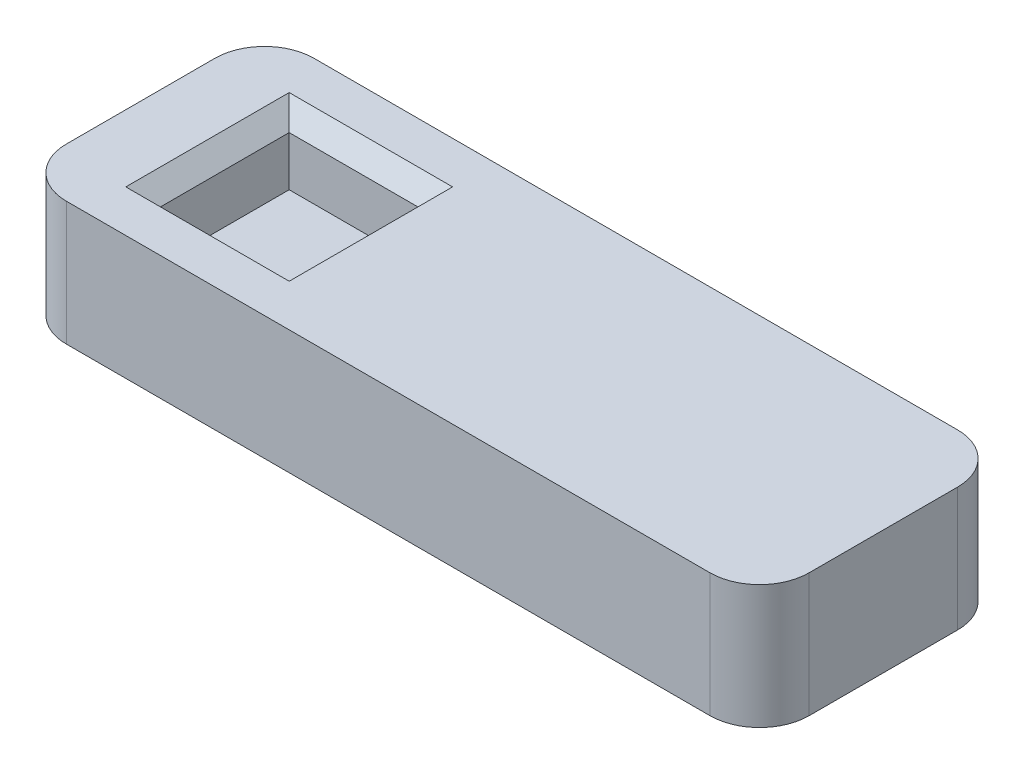
from build123d import *

# Parameters (mm, degrees)
ESBO_O1_W                = 30
ESBO_O1_H                = 10
RESSALTO_EXTRUS_O1_DEPTH = 5
ESBO_O2_W                = 5.2
ESBO_O2_H                = 5.2
CORTE_EXTRUS_O1_DEPTH    = 2.7
CHANFRO1_SIZE            = 0.7
FILETE1_R                = 2
FILETE2_R                = 2
FILETE3_R                = 2
FILETE4_R                = 2


with BuildPart() as part:
    # Esboço1 → Ressalto-extrusão1 (new body)
    with BuildSketch(Plane(origin=(0, 0, 0), x_dir=(1, 0, 0), z_dir=(0, 1, 0))):
        with Locations((15, 5)):
            Rectangle(ESBO_O1_W, ESBO_O1_H)
    extrude(amount=RESSALTO_EXTRUS_O1_DEPTH)

    # Esboço2 → Corte-extrusão1 (cut)
    with BuildSketch(Plane(origin=(0, 5, 0), x_dir=(1, 0, 0), z_dir=(0, 1, 0))):
        with Locations((6, 5)):
            Rectangle(ESBO_O2_W, ESBO_O2_H)
    extrude(amount=-CORTE_EXTRUS_O1_DEPTH, mode=Mode.SUBTRACT)

    # Chanfro1
    chanfro1_edges = [part.edges().sort_by_distance(p)[0] for p in [
        (8.6, 5, -5),
        (6, 5, -7.6),
        (3.4, 5, -5),
        (6, 5, -2.4),
    ]]
    chamfer(chanfro1_edges, length=CHANFRO1_SIZE)

    # Filete1
    filete1_edges = [part.edges().sort_by_distance(p)[0] for p in [
        (30, 2.5, 0),
    ]]
    fillet(filete1_edges, radius=FILETE1_R)

    # Filete2
    filete2_edges = [part.edges().sort_by_distance(p)[0] for p in [
        (30, 2.5, -10),
    ]]
    fillet(filete2_edges, radius=FILETE2_R)

    # Filete3
    filete3_edges = [part.edges().sort_by_distance(p)[0] for p in [
        (0, 2.5, 0),
    ]]
    fillet(filete3_edges, radius=FILETE3_R)

    # Filete4
    filete4_edges = [part.edges().sort_by_distance(p)[0] for p in [
        (0, 2.5, -10),
    ]]
    fillet(filete4_edges, radius=FILETE4_R)


solid = part.part
